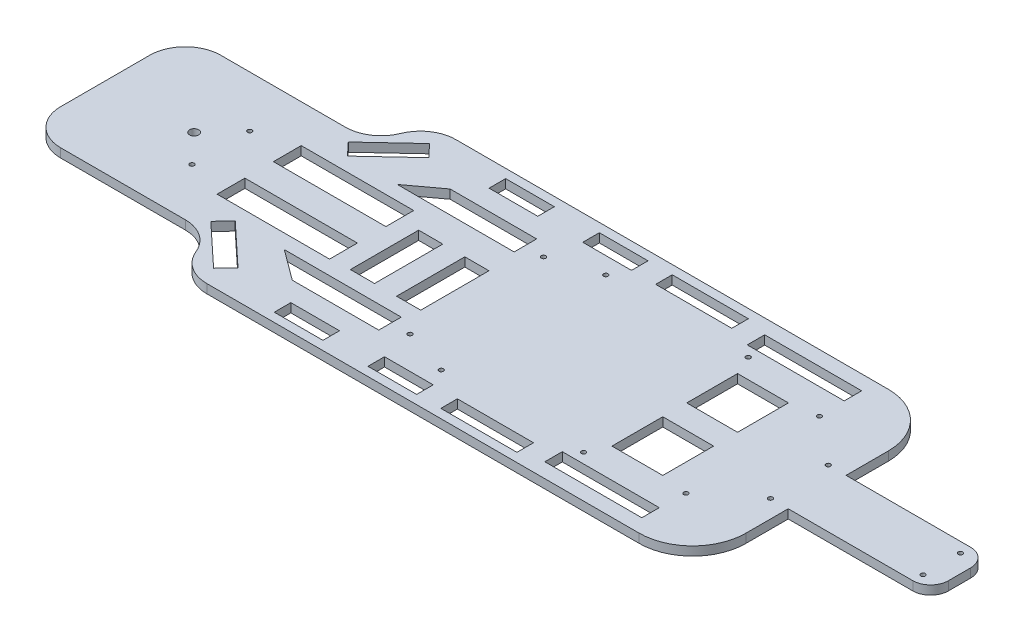
from build123d import *

# Parameters (mm, degrees)
SKETCH1_W                       = 27.36074774
SKETCH1_H                       = 9.31011233
SKETCH1_W_2                     = 63.184924932
SKETCH1_H_2                     = 15.628780018
SKETCH1_W_3                     = 28.563258108
SKETCH1_H_3                     = 28.563258107
SKETCH1_W_4                     = 54.490786644
SKETCH1_H_4                     = 9.808341596
BOSS_EXTRUDE2_DEPTH             = 5
M3X0_5_TAPPED_HOLE1_AT_2_COUNT  = 2
M3X0_5_TAPPED_HOLE1_AT_2_PITCH  = 84.353793631
M3X0_5_TAPPED_HOLE1_AT_3_COUNT  = 2
M3X0_5_TAPPED_HOLE1_AT_3_PITCH  = 80.206374435
M3X0_5_TAPPED_HOLE1_AT_4_COUNT  = 2
M3X0_5_TAPPED_HOLE1_AT_4_PITCH  = 116.569149337
M3X0_5_TAPPED_HOLE1_AT_5_COUNT  = 2
M3X0_5_TAPPED_HOLE1_AT_5_PITCH  = 109.605504319
M3X0_5_TAPPED_HOLE1_AT_6_COUNT  = 2
M3X0_5_TAPPED_HOLE1_AT_6_PITCH  = 241.733079083
M3X0_5_TAPPED_HOLE1_AT_7_COUNT  = 2
M3X0_5_TAPPED_HOLE1_AT_7_PITCH  = 165.040957875
M3X0_5_TAPPED_HOLE1_AT_8_COUNT  = 2
M3X0_5_TAPPED_HOLE1_AT_8_PITCH  = 159.0472187
M3X0_5_TAPPED_HOLE1_AT_9_COUNT  = 2
M3X0_5_TAPPED_HOLE1_AT_9_PITCH  = 237.681260353
M3X0_5_TAPPED_HOLE1_AT_10_COUNT = 2
M3X0_5_TAPPED_HOLE1_AT_10_PITCH = 265.601233698
M3X0_5_TAPPED_HOLE1_AT_11_COUNT = 2
M3X0_5_TAPPED_HOLE1_AT_11_PITCH = 262.61952582
M3X0_5_TAPPED_HOLE1_AT_12_COUNT = 2
M3X0_5_TAPPED_HOLE1_AT_12_PITCH = 405.882449116
M3X0_5_TAPPED_HOLE1_AT_13_COUNT = 2
M3X0_5_TAPPED_HOLE1_AT_13_PITCH = 405.040815845
M3X0_5_TAPPED_HOLE1_AT_14_COUNT = 2
M3X0_5_TAPPED_HOLE1_AT_14_PITCH = 21
SKETCH12_W                      = 13.567630433
SKETCH12_H                      = 38.351630467
SKETCH12_W_2                    = 42.773178661
SKETCH12_H_2                    = 9.31011233
CUT_EXTRUDE1_DEPTH              = 5


with BuildPart() as part:
    # Sketch1 → Boss-Extrude2 (new body)
    with BuildSketch(Plane(origin=(0, 0, 0), x_dir=(1, 0, 0), z_dir=(0, 1, 0))):
        with BuildLine():
            Line((0, -25), (0, 25))
            ThreePointArc((0, 25), (5.857864376, 39.142135624), (20, 45))
            Line((20, 45), (90, 45))
            ThreePointArc((90, 45), (101.180339887, 48.416876048), (108.540496218, 57.5))
            ThreePointArc((108.540496218, 57.5), (115.900652548, 66.583123952), (127.080992435, 70))
            Line((127.080992435, 70), (370, 70))
            ThreePointArc((370, 70), (391.213203436, 61.213203436), (400, 40))
            Line((400, 40), (400, 16.25))
            Line((400, 16.25), (470, 16.25))
            ThreePointArc((470, 16.25), (477.071067812, 13.321067812), (480, 6.25))
            Line((480, 6.25), (480, -6.25))
            ThreePointArc((480, -6.25), (477.071067812, -13.321067812), (470, -16.25))
            Line((470, -16.25), (400, -16.25))
            Line((400, -16.25), (400, -40))
            ThreePointArc((400, -40), (391.213203436, -61.213203436), (370, -70))
            Line((370, -70), (127.080992435, -70))
            ThreePointArc((127.080992435, -70), (115.900652548, -66.583123952), (108.540496218, -57.5))
            ThreePointArc((108.540496218, -57.5), (101.180339887, -48.416876048), (90, -45))
            Line((90, -45), (20, -45))
            ThreePointArc((20, -45), (5.857864376, -39.142135624), (0, -25))
        make_face()
        Polygon((97.973907034, 38.618759958), (121.583872386, 60.672024298), (128.212930651, 53.575032509), (104.602965298, 31.521768169), align=None, mode=Mode.SUBTRACT)
        with Locations((173.68037387, 60.344943835)):
            Rectangle(SKETCH1_W, SKETCH1_H, mode=Mode.SUBTRACT)
        with Locations((226.31962613, 60.344943835)):
            Rectangle(SKETCH1_W, SKETCH1_H, mode=Mode.SUBTRACT)
        Polygon((121.583872386, -60.672024298), (128.212930651, -53.575032509), (104.602965298, -31.521768169), (97.973907034, -38.618759958), align=None, mode=Mode.SUBTRACT)
        with Locations((118.108904399, 15.823440219)):
            Rectangle(SKETCH1_W_2, SKETCH1_H_2, mode=Mode.SUBTRACT)
        with Locations((334.281629054, 21.005470916)):
            Rectangle(SKETCH1_W_3, SKETCH1_H_3, mode=Mode.SUBTRACT)
        with Locations((336.01238987, 56.849636781)):
            Rectangle(SKETCH1_W_4, SKETCH1_H_4, mode=Mode.SUBTRACT)
        with Locations((173.68037387, -60.344943835)):
            Rectangle(SKETCH1_W, SKETCH1_H, mode=Mode.SUBTRACT)
        with Locations((226.31962613, -60.344943835)):
            Rectangle(SKETCH1_W, SKETCH1_H, mode=Mode.SUBTRACT)
        with Locations((336.01238987, -56.849636781)):
            Rectangle(SKETCH1_W_4, SKETCH1_H_4, mode=Mode.SUBTRACT)
        with Locations((334.281629054, -21.005470916)):
            Rectangle(SKETCH1_W_3, SKETCH1_H_3, mode=Mode.SUBTRACT)
        with Locations((118.108904399, -15.823440219)):
            Rectangle(SKETCH1_W_2, SKETCH1_H_2, mode=Mode.SUBTRACT)
    extrude(amount=BOSS_EXTRUDE2_DEPTH)

    # Sketch7 → M3x0.5 Tapped Hole1 (revolve, cut)
    with BuildSketch(Plane(origin=(470, 5, 10.5), x_dir=(0, 0, 1), z_dir=(1, 0, 0))):
        Polygon((0, 0), (0, 5), (1.525, 5), (1.25, 4.725), (1.25, 0), align=None)
    m3x0_5_tapped_hole1 = revolve(axis=Axis((470, 11.35, 10.5), (0, -1, 0)), mode=Mode.SUBTRACT)

    # M3x0.5 Tapped Hole1 at 2: M3x0.5 Tapped Hole1 ×2
    with Locations(*[Vector(-0.9483865106248197, 0, -0.3171167394901739) * (i * M3X0_5_TAPPED_HOLE1_AT_2_PITCH) for i in range(1, M3X0_5_TAPPED_HOLE1_AT_2_COUNT)]):
        add(m3x0_5_tapped_hole1, mode=Mode.SUBTRACT)

    # M3x0.5 Tapped Hole1 at 3: M3x0.5 Tapped Hole1 ×2
    with Locations(*[Vector(-0.9974269571912754, 0, 0.07169006254812285) * (i * M3X0_5_TAPPED_HOLE1_AT_3_PITCH) for i in range(1, M3X0_5_TAPPED_HOLE1_AT_3_COUNT)]):
        add(m3x0_5_tapped_hole1, mode=Mode.SUBTRACT)

    # M3x0.5 Tapped Hole1 at 4: M3x0.5 Tapped Hole1 ×2
    with Locations(*[Vector(-0.9112865611968157, 0, -0.4117727569692806) * (i * M3X0_5_TAPPED_HOLE1_AT_4_PITCH) for i in range(1, M3X0_5_TAPPED_HOLE1_AT_4_COUNT)]):
        add(m3x0_5_tapped_hole1, mode=Mode.SUBTRACT)

    # M3x0.5 Tapped Hole1 at 5: M3x0.5 Tapped Hole1 ×2
    with Locations(*[Vector(-0.9691839830527866, 0, 0.24633799340324214) * (i * M3X0_5_TAPPED_HOLE1_AT_5_PITCH) for i in range(1, M3X0_5_TAPPED_HOLE1_AT_5_COUNT)]):
        add(m3x0_5_tapped_hole1, mode=Mode.SUBTRACT)

    # M3x0.5 Tapped Hole1 at 6: M3x0.5 Tapped Hole1 ×2
    with Locations(*[Vector(-0.972052622294702, 0, -0.23476307096729135) * (i * M3X0_5_TAPPED_HOLE1_AT_6_PITCH) for i in range(1, M3X0_5_TAPPED_HOLE1_AT_6_COUNT)]):
        add(m3x0_5_tapped_hole1, mode=Mode.SUBTRACT)

    # M3x0.5 Tapped Hole1 at 7: M3x0.5 Tapped Hole1 ×2
    with Locations(*[Vector(-0.9390231092578303, 0, -0.34385403920814583) * (i * M3X0_5_TAPPED_HOLE1_AT_7_PITCH) for i in range(1, M3X0_5_TAPPED_HOLE1_AT_7_COUNT)]):
        add(m3x0_5_tapped_hole1, mode=Mode.SUBTRACT)

    # M3x0.5 Tapped Hole1 at 8: M3x0.5 Tapped Hole1 ×2
    with Locations(*[Vector(-0.9744104592657841, 0, 0.22477601489804) * (i * M3X0_5_TAPPED_HOLE1_AT_8_PITCH) for i in range(1, M3X0_5_TAPPED_HOLE1_AT_8_COUNT)]):
        add(m3x0_5_tapped_hole1, mode=Mode.SUBTRACT)

    # M3x0.5 Tapped Hole1 at 9: M3x0.5 Tapped Hole1 ×2
    with Locations(*[Vector(-0.98862347443418, 0, 0.15041152149250553) * (i * M3X0_5_TAPPED_HOLE1_AT_9_PITCH) for i in range(1, M3X0_5_TAPPED_HOLE1_AT_9_COUNT)]):
        add(m3x0_5_tapped_hole1, mode=Mode.SUBTRACT)

    # M3x0.5 Tapped Hole1 at 10: M3x0.5 Tapped Hole1 ×2
    with Locations(*[Vector(-0.9835342087984568, 0, -0.18072205212201886) * (i * M3X0_5_TAPPED_HOLE1_AT_10_PITCH) for i in range(1, M3X0_5_TAPPED_HOLE1_AT_10_COUNT)]):
        add(m3x0_5_tapped_hole1, mode=Mode.SUBTRACT)

    # M3x0.5 Tapped Hole1 at 11: M3x0.5 Tapped Hole1 ×2
    with Locations(*[Vector(-0.994700978251516, 0, 0.10281032956603646) * (i * M3X0_5_TAPPED_HOLE1_AT_11_PITCH) for i in range(1, M3X0_5_TAPPED_HOLE1_AT_11_COUNT)]):
        add(m3x0_5_tapped_hole1, mode=Mode.SUBTRACT)

    # M3x0.5 Tapped Hole1 at 12: M3x0.5 Tapped Hole1 ×2
    with Locations(*[Vector(-0.9978258505204469, 0, -0.0659057814849869) * (i * M3X0_5_TAPPED_HOLE1_AT_12_PITCH) for i in range(1, M3X0_5_TAPPED_HOLE1_AT_12_COUNT)]):
        add(m3x0_5_tapped_hole1, mode=Mode.SUBTRACT)

    # M3x0.5 Tapped Hole1 at 13: M3x0.5 Tapped Hole1 ×2
    with Locations(*[Vector(-0.9998992302925277, 0, 0.014196100183171115) * (i * M3X0_5_TAPPED_HOLE1_AT_13_PITCH) for i in range(1, M3X0_5_TAPPED_HOLE1_AT_13_COUNT)]):
        add(m3x0_5_tapped_hole1, mode=Mode.SUBTRACT)

    # M3x0.5 Tapped Hole1 at 14: M3x0.5 Tapped Hole1 ×2
    with Locations(*[(0, 0, -i * M3X0_5_TAPPED_HOLE1_AT_14_PITCH) for i in range(1, M3X0_5_TAPPED_HOLE1_AT_14_COUNT)]):
        add(m3x0_5_tapped_hole1, mode=Mode.SUBTRACT)

    # Sketch9 → 1/4-20 Tapped Hole1 (revolve, cut)
    with BuildSketch(Plane(origin=(50, 5, 0), x_dir=(0, 0, 1), z_dir=(1, 0, 0))):
        Polygon((0, 0), (0, 5), (3.81, 5), (2.5527, 3.7427), (2.5527, 0), align=None)
    revolve(axis=Axis((50, 11.35, 0), (0, -1, 0)), mode=Mode.SUBTRACT)

    # Sketch12 → Cut-Extrude1 (cut)
    with BuildSketch(Plane(origin=(0, 5, 0), x_dir=(1, 0, 0), z_dir=(0, 1, 0))):
        with Locations((167.418815824, -3.696545403)):
            Rectangle(SKETCH12_W, SKETCH12_H)
        with Locations((193.366452745, -3.696545403)):
            Rectangle(SKETCH12_W, SKETCH12_H)
        with Locations((274.966905924, 60.344943835)):
            Rectangle(SKETCH12_W_2, SKETCH12_H_2)
        with Locations((274.966905924, -60.344943835)):
            Rectangle(SKETCH12_W_2, SKETCH12_H_2)
        Polygon((132.36021003, 31.709406718), (149.471247182, 44.35453871), (198.060388772, 44.35453871), (198.060388772, 31.709406718), align=None)
        Polygon((198.060388772, -31.709406718), (132.36021003, -31.709406718), (149.471247182, -44.35453871), (198.060388772, -44.35453871), align=None)
    extrude(amount=-CUT_EXTRUDE1_DEPTH, mode=Mode.SUBTRACT)


solid = part.part
